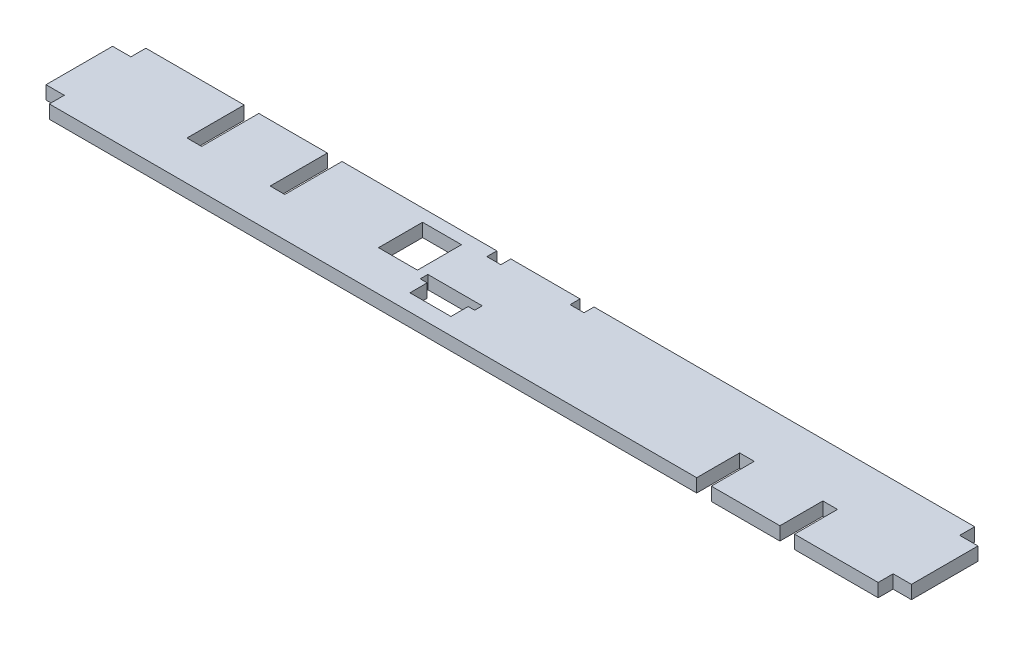
from build123d import *

# Parameters (mm, degrees)
EXTRUDE_1_DEPTH    = 4
SKETCH_2_W         = 20
SKETCH_2_H         = 4
EXTRUDE_2_DEPTH    = 5.5
SKETCH1_W          = 4.4
SKETCH1_H          = 17.190587951
CUT_EXTRUDE1_DEPTH = 10
LPATTERN1_COUNT    = 2
LPATTERN1_PITCH    = 25
SKETCH3_W          = 11.685912807
SKETCH3_H          = 13.236550351
CUT_EXTRUDE3_DEPTH = 10
SKETCH2_W          = 16.35313114
SKETCH2_H          = 2.289354212
SKETCH2_W_2        = 12.3172739
SKETCH2_H_2        = 5.182620656
CUT_EXTRUDE4_DEPTH = 10
SKETCH4_W          = 4.4
SKETCH4_H          = 12.896988848
CUT_EXTRUDE5_DEPTH = 10
LPATTERN2_COUNT    = 2
LPATTERN2_PITCH    = 25


with BuildPart() as part:
    # Эскиз1 → Бобышка-Вытянуть1 (new body)
    with BuildSketch(Plane(origin=(0, 0, 0), x_dir=(1, 0, 0), z_dir=(0, 1, 0))):
        Polygon((-14.85, 14.498494424), (5.95, 14.498494424), (5.95, 11.498494424), (10.15, 11.498494424), (10.15, 14.498494424), (124.5, 14.498494424), (124.5, -14.498494424), (-124.5, -14.498494424), (-124.5, 14.498494424), (-19.05, 14.498494424), (-19.05, 11.498494424), (-14.85, 11.498494424), align=None)
    extrude(amount=EXTRUDE_1_DEPTH)

    # Эскиз2 → Бобышка-Вытянуть2 (add)
    with BuildSketch(Plane(origin=(124.5, 0, 0), x_dir=(0, 0, -1), z_dir=(1, 0, 0))):
        with Locations((0, 2)):
            Rectangle(SKETCH_2_W, SKETCH_2_H)
    extrude_2 = extrude(amount=EXTRUDE_2_DEPTH)

    # Mirror1: Бобышка-Вытянуть2 across plane
    add(extrude_2.mirror(Plane(origin=(0, 0, 0), x_dir=(0, 0, 1), z_dir=(1, 0, 0))))

    # Sketch1 → Cut-Extrude1 (cut)
    with BuildSketch(Plane(origin=(0, 4, 0), x_dir=(1, 0, 0), z_dir=(0, 1, 0))):
        with Locations((-67.763838692, 5.903200448)):
            Rectangle(SKETCH1_W, SKETCH1_H)
    cut_extrude1 = extrude(amount=-CUT_EXTRUDE1_DEPTH, mode=Mode.SUBTRACT)

    # LPattern1: Cut-Extrude1 ×2
    with Locations(*[(-i * LPATTERN1_PITCH, 0, 0) for i in range(1, LPATTERN1_COUNT)]):
        add(cut_extrude1, mode=Mode.SUBTRACT)

    # Sketch3 → Cut-Extrude3 (cut)
    with BuildSketch(Plane(origin=(0, 0, 0), x_dir=(1, 0, 0), z_dir=(0, 1, 0))):
        with Locations((-31.80775481, 4.169260767)):
            Rectangle(SKETCH3_W, SKETCH3_H)
    extrude(amount=CUT_EXTRUDE3_DEPTH, mode=Mode.SUBTRACT)

    # Sketch2 → Cut-Extrude4 (cut)
    with BuildSketch(Plane.XZ):
        with Locations((-15.10817653, 3.144359058)):
            Rectangle(SKETCH2_W, SKETCH2_H)
        with Locations((-15.029613665, 6.880346492)):
            Rectangle(SKETCH2_W_2, SKETCH2_H_2)
    extrude(amount=-CUT_EXTRUDE4_DEPTH, mode=Mode.SUBTRACT)

    # Sketch4 → Cut-Extrude5 (cut)
    with BuildSketch(Plane(origin=(0, 4, 0), x_dir=(1, 0, 0), z_dir=(0, 1, 0))):
        with Locations((72.185759894, -8.05)):
            Rectangle(SKETCH4_W, SKETCH4_H)
    cut_extrude5 = extrude(amount=-CUT_EXTRUDE5_DEPTH, mode=Mode.SUBTRACT)

    # LPattern2: Cut-Extrude5 ×2
    with Locations(*[(i * LPATTERN2_PITCH, 0, 0) for i in range(1, LPATTERN2_COUNT)]):
        add(cut_extrude5, mode=Mode.SUBTRACT)


solid = part.part
